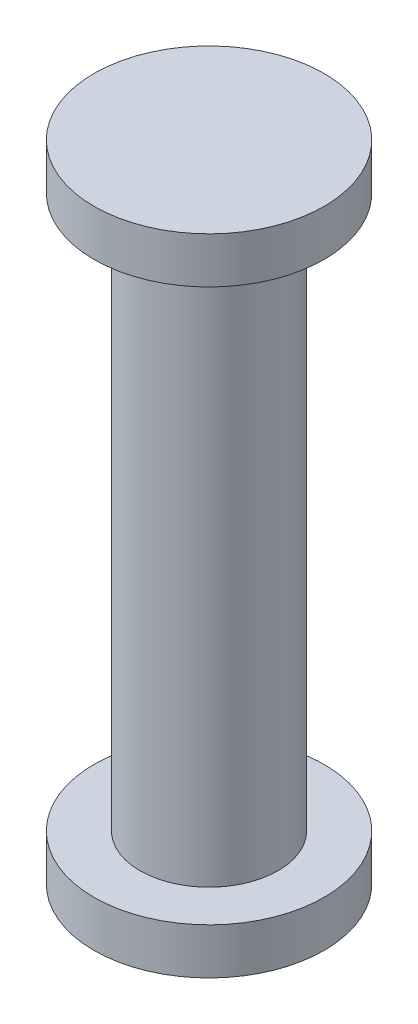
from build123d import *

# Parameters (mm, degrees)
SKETCH1_R           = 2.5
BOSS_EXTRUDE1_DEPTH = 1
SKETCH2_R           = 1.5
BOSS_EXTRUDE2_DEPTH = 12
SKETCH3_R           = 2.5
BOSS_EXTRUDE3_DEPTH = 1


with BuildPart() as part:
    # Sketch1 → Boss-Extrude1 (new body)
    with BuildSketch(Plane(origin=(0, 0, 0), x_dir=(1, 0, 0), z_dir=(0, 1, 0))):
        with Locations(Location((0, 0, 0), (0, 0, 270))):
            Circle(SKETCH1_R)
    extrude(amount=BOSS_EXTRUDE1_DEPTH)

    # Sketch2 → Boss-Extrude2 (add)
    with BuildSketch(Plane(origin=(0, 1, 0), x_dir=(1, 0, 0), z_dir=(0, 1, 0))):
        with Locations(Location((0, 0, 0), (0, 0, 270))):
            Circle(SKETCH2_R)
    extrude(amount=BOSS_EXTRUDE2_DEPTH)

    # Sketch3 → Boss-Extrude3 (add)
    with BuildSketch(Plane(origin=(0, 13, 0), x_dir=(1, 0, 0), z_dir=(0, 1, 0))):
        with Locations(Location((0, 0, 0), (0, 0, 270))):
            Circle(SKETCH3_R)
    extrude(amount=BOSS_EXTRUDE3_DEPTH)


solid = part.part
